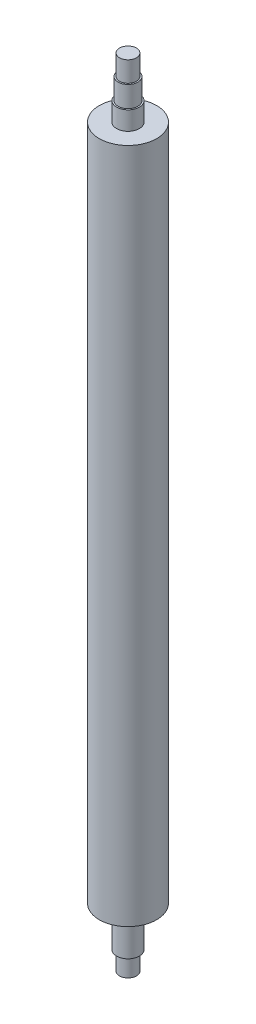
from build123d import *

# Parameters (mm, degrees)
SKETCH1_R            = 10
BOSS_EXTRUDE8_DEPTH  = 236
SKETCH1_9_R          = 3.965
BOSS_EXTRUDE9_DEPTH  = 14
BOSS_EXTRUDE10_START = -14
SKETCH1_10_R         = 2.95
BOSS_EXTRUDE10_DEPTH = 6.5
BOSS_EXTRUDE11_START = 242.5
SKETCH1_11_R         = 3.965
BOSS_EXTRUDE11_DEPTH = 6.5
BOSS_EXTRUDE12_START = 242.5
SKETCH1_12_R         = 3.45
BOSS_EXTRUDE12_DEPTH = 7.3
BOSS_EXTRUDE13_START = 256.9
SKETCH1_13_R         = 2.95
BOSS_EXTRUDE13_DEPTH = 7.1


with BuildPart() as part:
    # Sketch1 → Boss-Extrude8 (new body)
    with BuildSketch(Plane(origin=(0, 0, 0), x_dir=(1, 0, 0), z_dir=(0, 1, 0))):
        with Locations(Location((0, 0, 0), (0, 0, 270))):
            Circle(SKETCH1_R)
    extrude(amount=BOSS_EXTRUDE8_DEPTH)

    # Sketch1<9> → Boss-Extrude9 (add)
    with BuildSketch(Plane(origin=(0, 0, 0), x_dir=(1, 0, 0), z_dir=(0, 1, 0))):
        with Locations(Location((0, 0, 0), (0, 0, 270))):
            Circle(SKETCH1_9_R)
    extrude(amount=-BOSS_EXTRUDE9_DEPTH)

    # Sketch1<10> → Boss-Extrude10 (add)
    with BuildSketch(Plane(origin=(0, 0, 0), x_dir=(1, 0, 0), z_dir=(0, 1, 0)).offset(BOSS_EXTRUDE10_START)):
        with Locations(Location((0, 0, 0), (0, 0, 270))):
            Circle(SKETCH1_10_R)
    extrude(amount=-BOSS_EXTRUDE10_DEPTH)

    # Sketch1<11> → Boss-Extrude11 (add)
    with BuildSketch(Plane(origin=(0, 0, 0), x_dir=(1, 0, 0), z_dir=(0, 1, 0)).offset(BOSS_EXTRUDE11_START)):
        with Locations(Location((0, 0, 0), (0, 0, 270))):
            Circle(SKETCH1_11_R)
    extrude(amount=-BOSS_EXTRUDE11_DEPTH)

    # Sketch1<12> → Boss-Extrude12 (add)
    with BuildSketch(Plane(origin=(0, 0, 0), x_dir=(1, 0, 0), z_dir=(0, 1, 0)).offset(BOSS_EXTRUDE12_START)):
        with Locations(Location((0, 0, 0), (0, 0, 270))):
            Circle(SKETCH1_12_R)
    extrude(amount=BOSS_EXTRUDE12_DEPTH)

    # Sketch1<13> → Boss-Extrude13 (add)
    with BuildSketch(Plane(origin=(0, 0, 0), x_dir=(1, 0, 0), z_dir=(0, 1, 0)).offset(BOSS_EXTRUDE13_START)):
        with Locations(Location((0, 0, 0), (0, 0, 270))):
            Circle(SKETCH1_13_R)
    extrude(amount=-BOSS_EXTRUDE13_DEPTH)


solid = part.part
